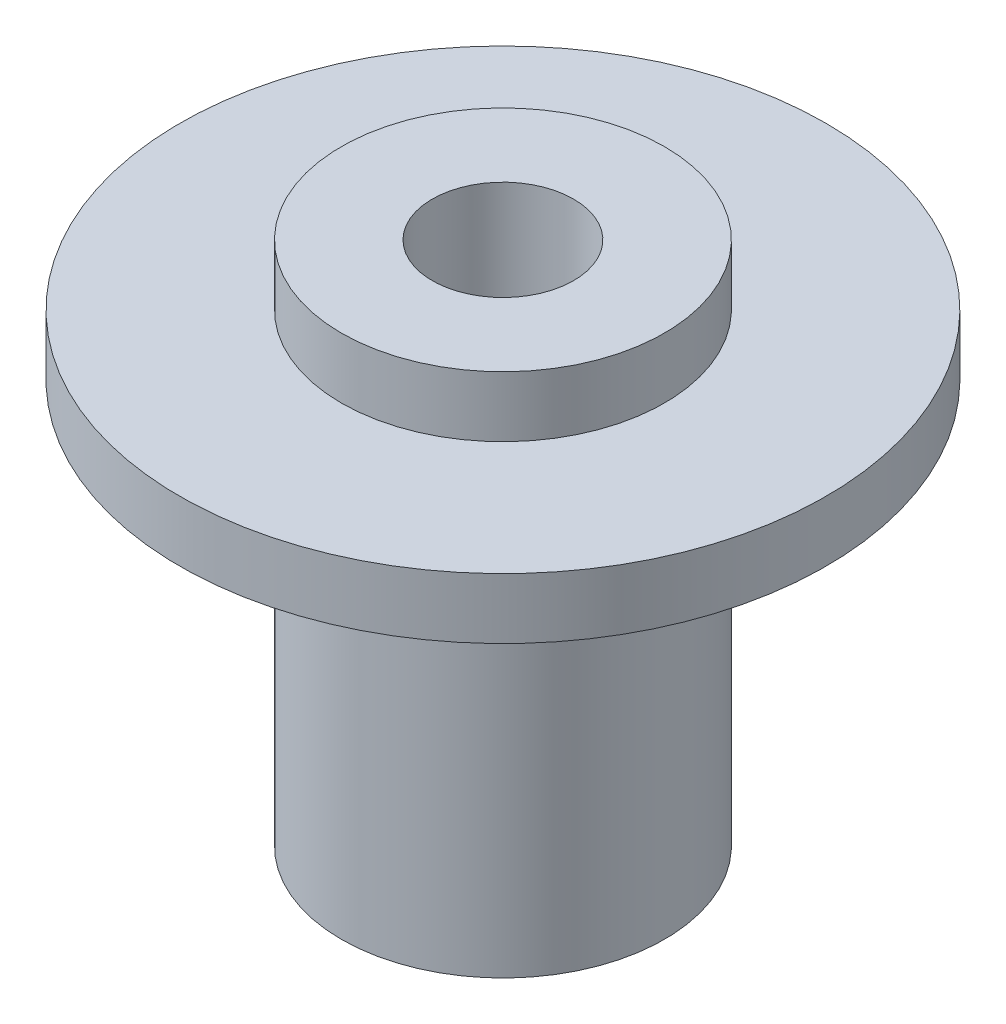
from build123d import *

# Parameters (mm, degrees)
SKETCH2_W = 80
SKETCH2_H = 200
SKETCH4_W = 35
SKETCH4_H = 304.864877585


with BuildPart() as part:
    # Sketch2 → Revolve3 (revolve)
    with BuildSketch(Plane.XY, mode=Mode.PRIVATE) as revolve3_sk:
        Polygon((-25, 0), (0, 0), (0, 30), (-80, 30), (-80, 0), align=None)
        Polygon((0, -30), (0, 0), (-25, 0), (-80, 0), (-160, 0), (-160, -30), (-80, -30), align=None)
        with Locations((-40, -130)):
            Rectangle(SKETCH2_W, SKETCH2_H)
    revolve(revolve3_sk.sketch.rotate(Axis((0, -55, 0), (0, 1, 0)), 270), axis=Axis((0, -55, 0), (0, 1, 0)))

    # Sketch4 → Cut-Revolve7 (revolve, cut)
    with BuildSketch(Plane.XY, mode=Mode.PRIVATE) as cut_revolve7_sk:
        with Locations((-17.5, -99.023733968)):
            Rectangle(SKETCH4_W, SKETCH4_H)
    revolve(cut_revolve7_sk.sketch.rotate(Axis((0, -55, 0), (0, 1, 0)), 270), axis=Axis((0, -55, 0), (0, 1, 0)), mode=Mode.SUBTRACT)


solid = part.part
